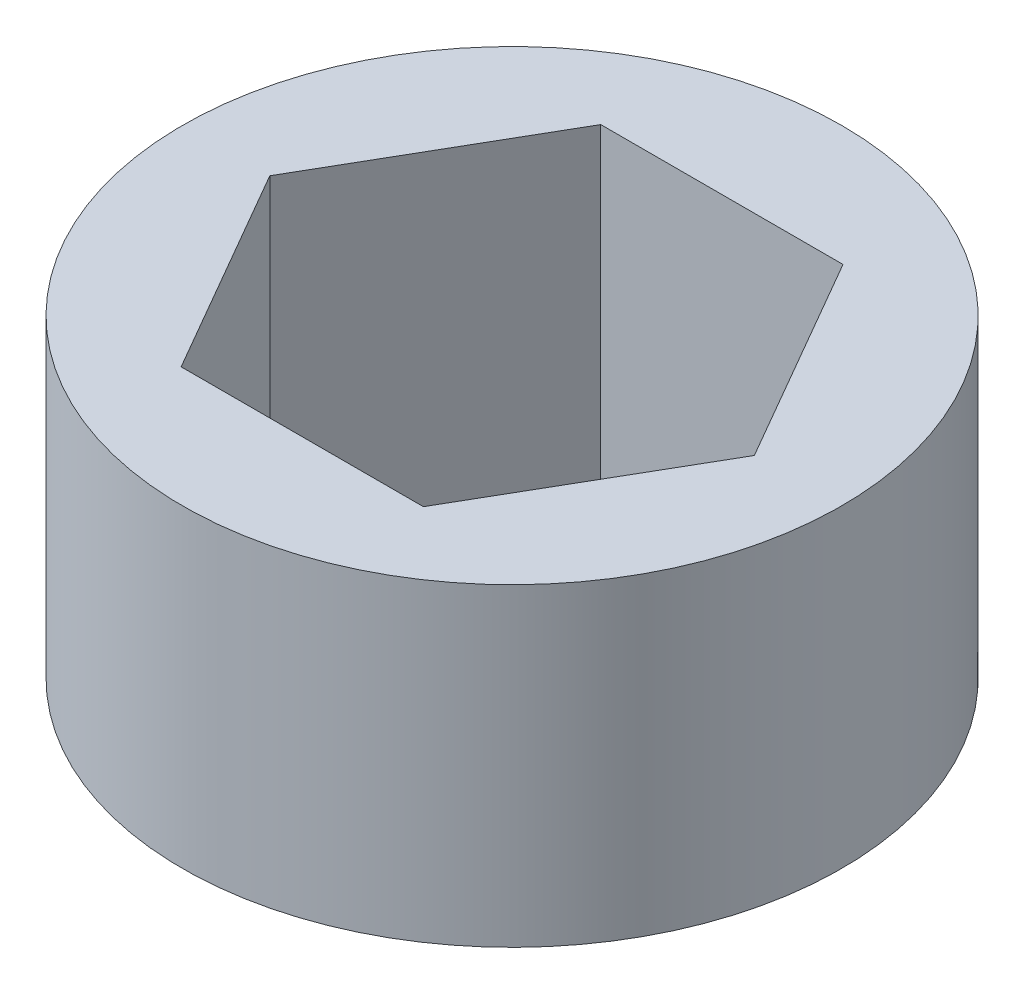
from build123d import *

# Parameters (mm, degrees)
SKETCH1_R           = 9.9949
BOSS_EXTRUDE1_DEPTH = 9.525


with BuildPart() as part:
    # Sketch1 → Boss-Extrude1 (new body)
    with BuildSketch(Plane(origin=(0, 0, 0), x_dir=(1, 0, 0), z_dir=(0, 1, 0))):
        with Locations(Location((0, 0, 0), (0, 0, 90))):
            Circle(SKETCH1_R)
        Polygon((7.347013116, 0), (3.673506558, 6.3627), (-3.673506558, 6.3627), (-7.347013116, 0), (-3.673506558, -6.3627), (3.673506558, -6.3627), align=None, mode=Mode.SUBTRACT)
    extrude(amount=BOSS_EXTRUDE1_DEPTH)


solid = part.part
